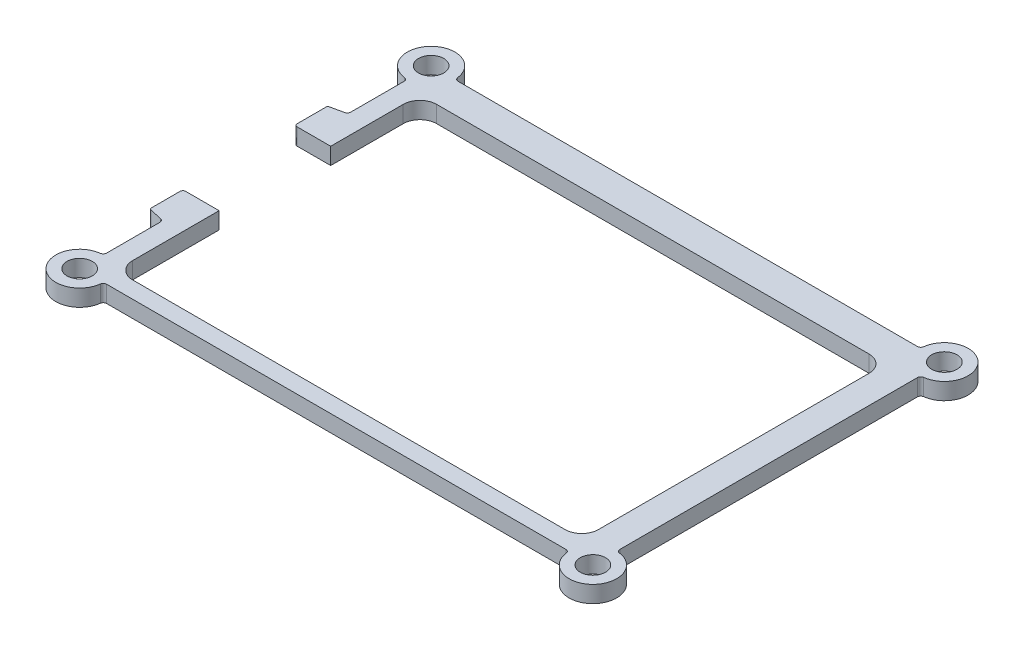
from build123d import *

# Parameters (mm, degrees)
SKETCH3_R           = 2.265
BOSS_EXTRUDE2_DEPTH = 3
SKETCH4_W           = 6.5
SKETCH4_H           = 20
CUT_EXTRUDE1_DEPTH  = 3
BOSS_EXTRUDE3_DEPTH = 3
FILLET1_R           = 0.6
CUT_EXTRUDE2_DEPTH  = 3


with BuildPart() as part:
    # Sketch3 → Boss-Extrude2 (new body)
    with BuildSketch(Plane(origin=(0, 0, 0), x_dir=(1, 0, 0), z_dir=(0, 1, 0))):
        with BuildLine():
            Line((0, -4.265), (0, -58.735))
            ThreePointArc((0, -58.735), (-3.015810422, -66.015810422), (4.265, -63))
            Line((4.265, -63), (87.735, -63))
            ThreePointArc((87.735, -63), (95.015810422, -66.015810422), (92, -58.735))
            Line((92, -58.735), (92, -4.265))
            ThreePointArc((92, -4.265), (95.015810422, 3.015810422), (87.735, 0))
            Line((87.735, 0), (4.265, 0))
            ThreePointArc((4.265, 0), (-3.015810422, 3.015810422), (0, -4.265))
        make_face()
        with Locations(Location((0, 0, 0), (0, 0, 270))):
            Circle(SKETCH3_R, mode=Mode.SUBTRACT)
        with Locations(Location((92, 0, 0), (0, 0, 270))):
            Circle(SKETCH3_R, mode=Mode.SUBTRACT)
        with Locations(Location((92, -63, 0), (0, 0, 270))):
            Circle(SKETCH3_R, mode=Mode.SUBTRACT)
        with Locations(Location((0, -63, 0), (0, 0, 270))):
            Circle(SKETCH3_R, mode=Mode.SUBTRACT)
    extrude(amount=BOSS_EXTRUDE2_DEPTH)

    # Sketch4 → Cut-Extrude1 (cut)
    with BuildSketch(Plane(origin=(0, 3, 0), x_dir=(1, 0, 0), z_dir=(0, 1, 0))):
        with Locations((3.25, -31.5)):
            Rectangle(SKETCH4_W, SKETCH4_H)
    extrude(amount=-CUT_EXTRUDE1_DEPTH, mode=Mode.SUBTRACT)

    # Sketch5 → Boss-Extrude3 (add)
    with BuildSketch(Plane(origin=(0, 3, 0), x_dir=(1, 0, 0), z_dir=(0, 1, 0))):
        with BuildLine():
            Line((0, -21.5), (-2.5, -21.5))
            ThreePointArc((-2.5, -21.5), (-2.853553391, -21.353553391), (-3, -21))
            Line((-3, -21), (-3, -15.8))
            ThreePointArc((-3, -15.8), (-2.912132034, -15.587867966), (-2.7, -15.5))
            Line((-2.7, -15.5), (0, -14.9))
            Line((0, -14.9), (0, -21.5))
        make_face()
        with BuildLine():
            Line((-3, -42), (-3, -47.2))
            ThreePointArc((-3, -47.2), (-2.912132034, -47.412132034), (-2.7, -47.5))
            Line((-2.7, -47.5), (0, -48.1))
            Line((0, -48.1), (0, -41.5))
            Line((0, -41.5), (-2.5, -41.5))
            ThreePointArc((-2.5, -41.5), (-2.853553391, -41.646446609), (-3, -42))
        make_face()
    extrude(amount=-BOSS_EXTRUDE3_DEPTH)

    # Fillet1
    fillet1_edges = [part.edges().sort_by_distance(p)[0] for p in [
        (92, 1.5, 4.265),
        (92, 1.5, 58.735),
        (87.735, 1.5, 63),
        (4.265, 1.5, 63),
        (0, 1.5, 58.735),
        (0, 1.5, 4.265),
        (4.265, 1.5, 0),
        (87.735, 1.5, 0),
        (6.5, 1.5, 21.5),
        (6.5, 1.5, 41.5),
        (0, 1.5, 14.9),
        (0, 1.5, 48.1),
    ]]
    fillet(fillet1_edges, radius=FILLET1_R)

    # Sketch7 → Cut-Extrude2 (cut)
    with BuildSketch(Plane(origin=(0, 3, 0), x_dir=(1, 0, 0), z_dir=(0, 1, 0))):
        with BuildLine():
            Line((6.5, -5.5), (84, -5.5))
            ThreePointArc((84, -5.5), (86.121320344, -6.378679656), (87, -8.5))
            Line((87, -8.5), (87, -57))
            ThreePointArc((87, -57), (86.121320344, -59.121320344), (84, -60))
            Line((84, -60), (6.5, -60))
            ThreePointArc((6.5, -60), (4.378679656, -59.121320344), (3.5, -57))
            Line((3.5, -57), (3.5, -8.5))
            ThreePointArc((3.5, -8.5), (4.378679656, -6.378679656), (6.5, -5.5))
        make_face()
    extrude(amount=-CUT_EXTRUDE2_DEPTH, mode=Mode.SUBTRACT)


solid = part.part
